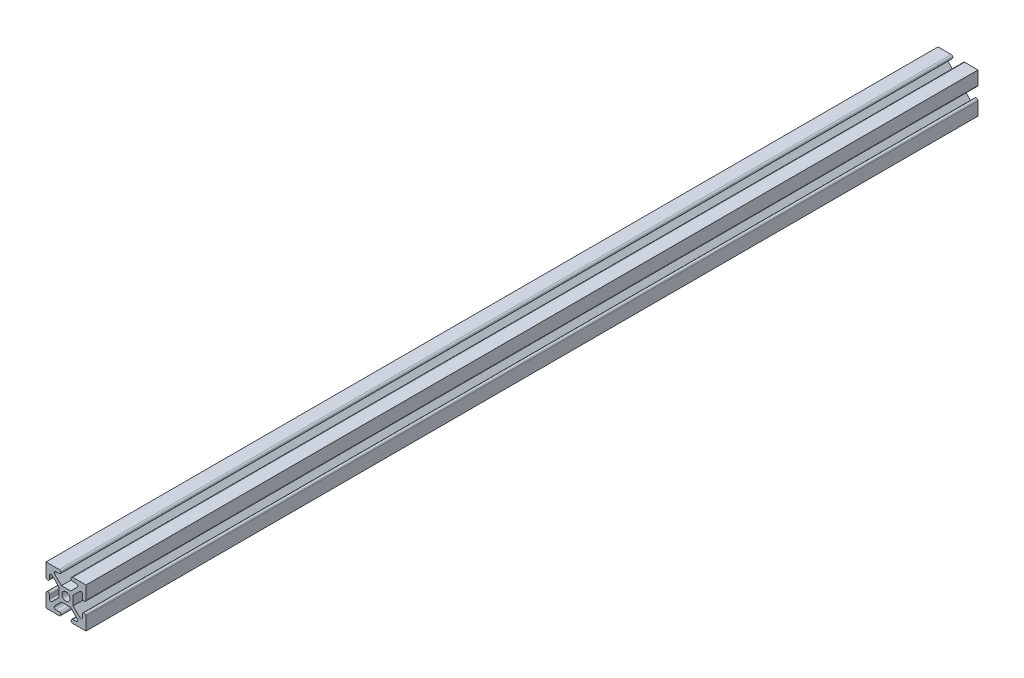
from build123d import *

# Parameters (mm, degrees)
SKETCH1_R           = 2.6035
BOSS_EXTRUDE1_DEPTH = 566.7375


with BuildPart() as part:
    # Sketch1 → Boss-Extrude1 (new body)
    with BuildSketch(Plane.XY):
        with BuildLine():
            Line((-12.7, -12.7), (-4.343399971, -12.7))
            ThreePointArc((-4.343399971, -12.7), (-3.238499971, -11.5951), (-4.343399971, -10.4902))
            Line((-4.343399971, -10.4902), (-6.474794456, -10.4902))
            ThreePointArc((-6.474794456, -10.4902), (-7.413456061, -9.863006367), (-7.193214945, -8.75577951))
            Line((-7.193214945, -8.75577951), (-2.933235435, -4.4958))
            Line((-2.933235435, -4.4958), (2.933235435, -4.4958))
            Line((2.933235435, -4.4958), (7.193214945, -8.75577951))
            ThreePointArc((7.193214945, -8.75577951), (7.413456061, -9.863006367), (6.474794456, -10.4902))
            Line((6.474794456, -10.4902), (4.3434, -10.4902))
            ThreePointArc((4.3434, -10.4902), (3.2385, -11.5951), (4.3434, -12.7))
            Line((4.3434, -12.7), (12.7, -12.7))
            Line((12.7, -12.7), (12.7, -4.343399971))
            ThreePointArc((12.7, -4.343399971), (11.5951, -3.238499971), (10.4902, -4.343399971))
            Line((10.4902, -4.343399971), (10.4902, -6.474794456))
            ThreePointArc((10.4902, -6.474794456), (9.863006367, -7.413456061), (8.75577951, -7.193214945))
            Line((8.75577951, -7.193214945), (4.4958, -2.933235435))
            Line((4.4958, -2.933235435), (4.4958, 2.933235435))
            Line((4.4958, 2.933235435), (8.75577951, 7.193214945))
            ThreePointArc((8.75577951, 7.193214945), (9.863006367, 7.413456061), (10.4902, 6.474794456))
            Line((10.4902, 6.474794456), (10.4902, 4.3434))
            ThreePointArc((10.4902, 4.3434), (11.5951, 3.2385), (12.7, 4.3434))
            Line((12.7, 4.3434), (12.7, 12.7))
            Line((12.7, 12.7), (4.343399971, 12.7))
            ThreePointArc((4.343399971, 12.7), (3.238499971, 11.5951), (4.343399971, 10.4902))
            Line((4.343399971, 10.4902), (6.474794456, 10.4902))
            ThreePointArc((6.474794456, 10.4902), (7.413456061, 9.863006367), (7.193214945, 8.75577951))
            Line((7.193214945, 8.75577951), (2.933235435, 4.4958))
            Line((2.933235435, 4.4958), (-2.933235435, 4.4958))
            Line((-2.933235435, 4.4958), (-7.193214945, 8.75577951))
            ThreePointArc((-7.193214945, 8.75577951), (-7.413456061, 9.863006367), (-6.474794456, 10.4902))
            Line((-6.474794456, 10.4902), (-4.3434, 10.4902))
            ThreePointArc((-4.3434, 10.4902), (-3.2385, 11.5951), (-4.3434, 12.7))
            Line((-4.3434, 12.7), (-12.7, 12.7))
            Line((-12.7, 12.7), (-12.7, 4.343399971))
            ThreePointArc((-12.7, 4.343399971), (-11.5951, 3.238499971), (-10.4902, 4.343399971))
            Line((-10.4902, 4.343399971), (-10.4902, 6.474794456))
            ThreePointArc((-10.4902, 6.474794456), (-9.863006367, 7.413456061), (-8.75577951, 7.193214945))
            Line((-8.75577951, 7.193214945), (-4.4958, 2.933235435))
            Line((-4.4958, 2.933235435), (-4.4958, -2.933235435))
            Line((-4.4958, -2.933235435), (-8.75577951, -7.193214945))
            ThreePointArc((-8.75577951, -7.193214945), (-9.863006367, -7.413456061), (-10.4902, -6.474794456))
            Line((-10.4902, -6.474794456), (-10.4902, -4.3434))
            ThreePointArc((-10.4902, -4.3434), (-11.5951, -3.2385), (-12.7, -4.3434))
            Line((-12.7, -4.3434), (-12.7, -12.7))
        make_face()
        Circle(SKETCH1_R, mode=Mode.SUBTRACT)
    extrude(amount=-BOSS_EXTRUDE1_DEPTH)


solid = part.part
